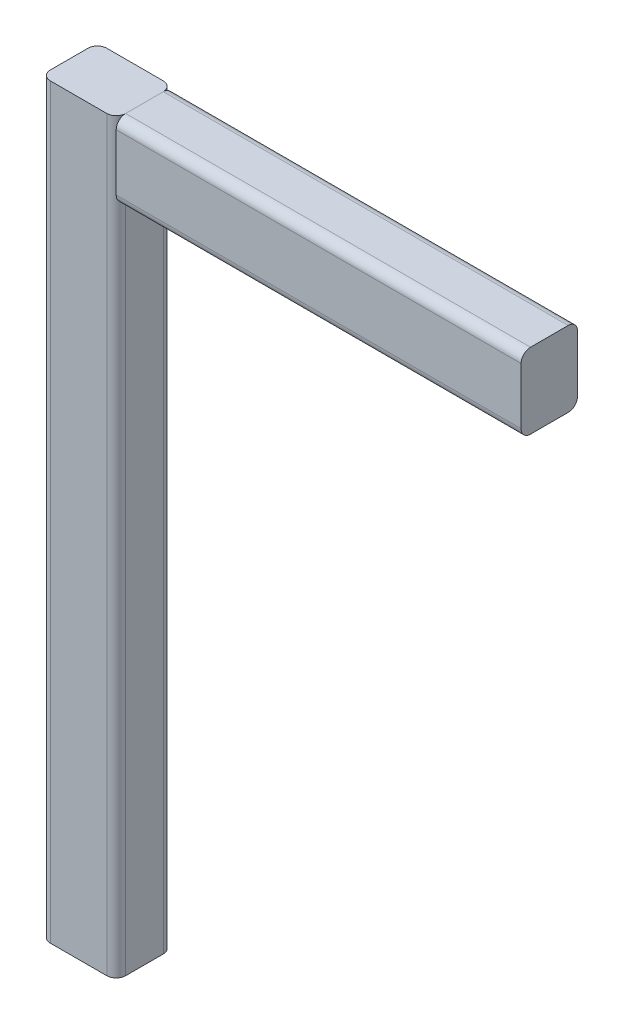
from build123d import *

# Parameters (mm, degrees)
SKETCH1_W           = 80
SKETCH1_H           = 793.139508354
BOSS_EXTRUDE1_DEPTH = 60
SKETCH2_W           = 60
SKETCH2_H           = 80
BOSS_EXTRUDE2_DEPTH = 430
FILLET1_R           = 10
FILLET2_R           = 10


with BuildPart() as part:
    # Sketch1 → Boss-Extrude1 (new body)
    with BuildSketch(Plane.XY):
        with Locations((-40, -396.569754177)):
            Rectangle(SKETCH1_W, SKETCH1_H)
    extrude(amount=-BOSS_EXTRUDE1_DEPTH)

    # Fillet1
    fillet1_edges = [part.edges().sort_by_distance(p)[0] for p in [
        (-80, -396.569754177, -60),
        (0, -396.569754177, -60),
        (-80, -396.569754177, 0),
        (0, -396.569754177, 0),
    ]]
    fillet(fillet1_edges, radius=FILLET1_R)


with BuildPart() as body_2:
    # Sketch2 → Boss-Extrude2 (new body)
    with BuildSketch(Plane(origin=(0, 0, 0), x_dir=(0, 0, -1), z_dir=(1, 0, 0))):
        with Locations((30, -40)):
            Rectangle(SKETCH2_W, SKETCH2_H)
    extrude(amount=BOSS_EXTRUDE2_DEPTH)

    # Fillet2
    fillet2_edges = [body_2.edges().sort_by_distance(p)[0] for p in [
        (215, 0, 0),
        (215, 0, -60),
        (215, -80, -60),
        (215, -80, 0),
    ]]
    fillet(fillet2_edges, radius=FILLET2_R)


solid = Compound([part.part, body_2.part])
